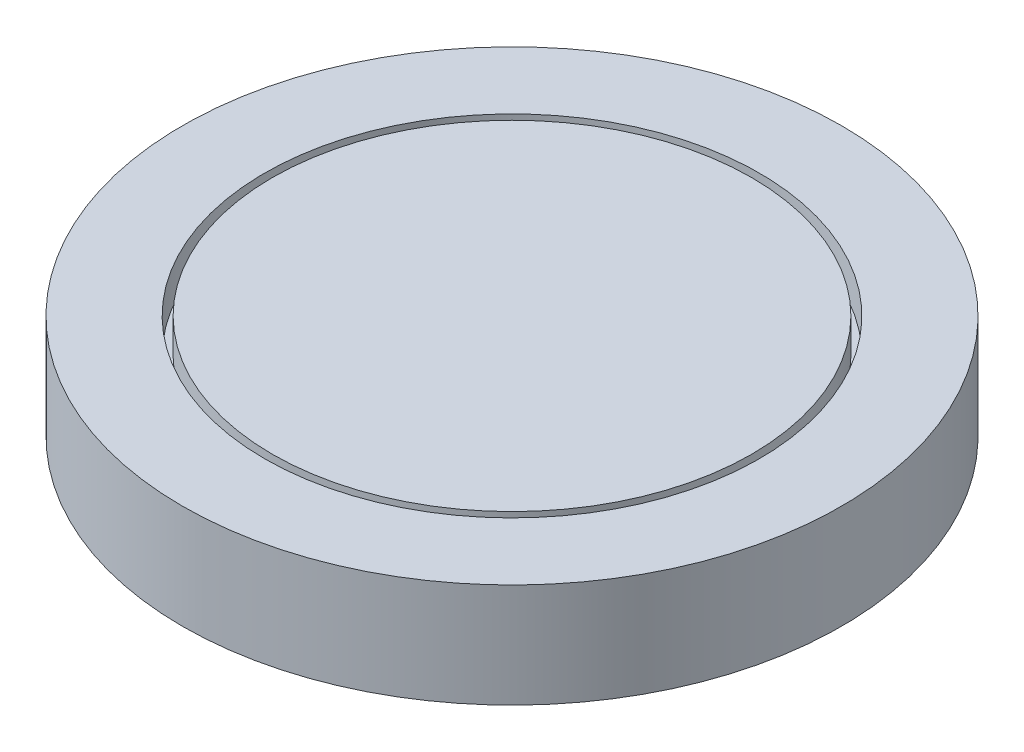
from build123d import *

# Parameters (mm, degrees)
SKETCH_1_R          = 9.5
EXTRUDE_1_DEPTH     = 3
SKETCH_2_R          = 7.13206418
CUT_EXTRUDE_1_DEPTH = 1
SKETCH_3_R          = 6.908184584
EXTRUDE_2_DEPTH     = 1


with BuildPart() as part:
    # 草图1 → 凸台-拉伸1 (new body)
    with BuildSketch(Plane(origin=(0, 0, 0), x_dir=(1, 0, 0), z_dir=(0, 1, 0))):
        with Locations(Location((0, 0, 0), (0, 0, 270))):
            Circle(SKETCH_1_R)
    extrude(amount=EXTRUDE_1_DEPTH)

    # 草图2 → 切除-拉伸1 (cut)
    with BuildSketch(Plane(origin=(0, 3, 0), x_dir=(1, 0, 0), z_dir=(0, 1, 0))):
        with Locations(Location((0, 0, 0), (0, 0, 270))):
            Circle(SKETCH_2_R)
    extrude(amount=-CUT_EXTRUDE_1_DEPTH, mode=Mode.SUBTRACT)

    # 草图3 → 凸台-拉伸2 (add)
    with BuildSketch(Plane(origin=(0, 2, 0), x_dir=(1, 0, 0), z_dir=(0, 1, 0))):
        with Locations(Location((0, 0, 0), (0, 0, 270))):
            Circle(SKETCH_3_R)
    extrude(amount=EXTRUDE_2_DEPTH)


solid = part.part
